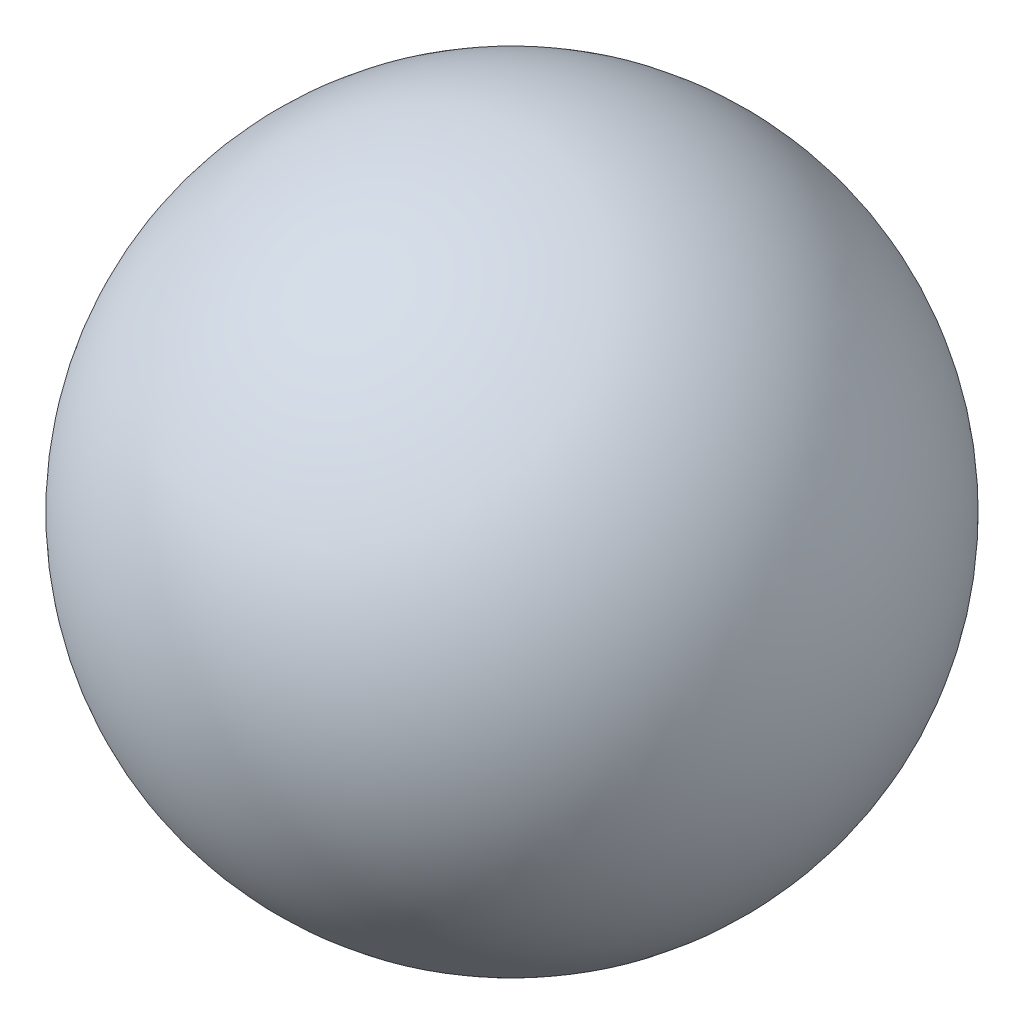
from build123d import *

# Parameters (mm, degrees)
SKIZZE3_R     = 1.5
SKIZZE3_R_2   = 0.5
ACHSE_1_DEPTH = 5
SKIZZE4_R     = 1.5
SKIZZE4_R_2   = 0.5
ACHSE_2_DEPTH = 5


with BuildPart() as part:
    # Skizze2 → Kugel (revolve)
    with BuildSketch(Plane(origin=(0, 0, 0), x_dir=(0, 0, -1), z_dir=(1, 0, 0))):
        with BuildLine():
            Line((0, 6), (0, -6))
            ThreePointArc((0, -6), (6, 0), (0, 6))
        make_face()
    revolve(axis=Axis((0, 23.376095618, 0), (0, -1, 0)))

    # Skizze3 → Achse 1 (cut, symmetric)
    with BuildSketch(Plane(origin=(0, 0, 0), x_dir=(0, 0, -1), z_dir=(1, 0, 0))):
        Circle(SKIZZE3_R)
        with Locations((0, 2.5)):
            Circle(SKIZZE3_R_2)
    extrude(amount=ACHSE_1_DEPTH, both=True, mode=Mode.SUBTRACT)

    # Skizze4 → Achse 2 (cut, symmetric)
    with BuildSketch(Plane(origin=(0, 0, 0), x_dir=(1, 0, 0), z_dir=(0, 1, 0))):
        with Locations(Location((0, 0, 0), (0, 0, 270))):
            Circle(SKIZZE4_R)
        with Locations(Location((0, 2.5, 0), (0, 0, 270))):
            Circle(SKIZZE4_R_2)
    extrude(amount=ACHSE_2_DEPTH, both=True, mode=Mode.SUBTRACT)


solid = part.part
